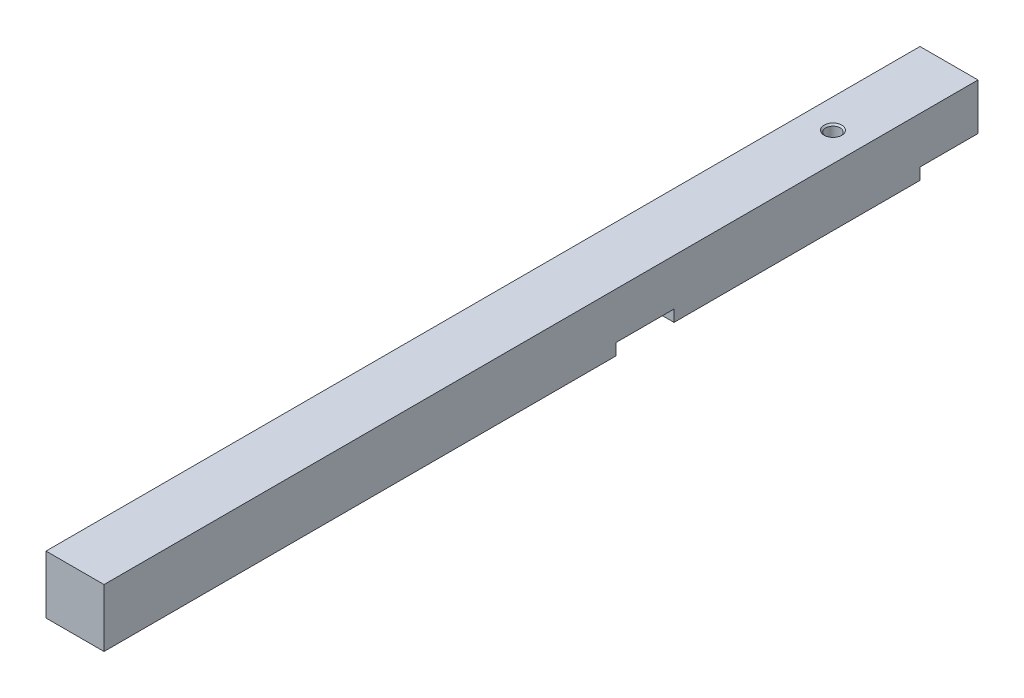
from build123d import *

# Parameters (mm, degrees)
ESQUISSE1_W                     = 10
ESQUISSE1_H                     = 10
BOSS_EXTRU_1_DEPTH              = 150.664880645
ESQUISSE2_W                     = 10
ESQUISSE2_H                     = 2
ENL_V_MAT_EXTRU_1_DEPTH         = 152.079139062
TROU_TARAUD_M3X0_51_D           = 2.5
TROU_TARAUD_M3X0_51_CSINK_D     = 3.05
TROU_TARAUD_M3X0_51_CSINK_ANGLE = 90


with BuildPart() as part:
    # Esquisse1 → Boss.-Extru.1 (new body)
    with BuildSketch(Plane.XY):
        Rectangle(ESQUISSE1_W, ESQUISSE1_H)
    extrude(amount=BOSS_EXTRU_1_DEPTH)

    # Esquisse2 → Enlèv. mat.-Extru.1 (cut, through all)
    with BuildSketch(Plane.ZY.offset(5)):
        with Locations((5, -4)):
            Rectangle(ESQUISSE2_W, ESQUISSE2_H)
        with Locations((57.4, -4)):
            Rectangle(ESQUISSE2_W, ESQUISSE2_H)
    extrude(amount=-ENL_V_MAT_EXTRU_1_DEPTH, mode=Mode.SUBTRACT)

    # Trou taraudé M3x0.51 (through all)
    with Locations(Plane(origin=(0, 5, 0), x_dir=(1, 0, 0), z_dir=(0, 1, 0))):
        with Locations((0, -20)):
            CounterSinkHole(TROU_TARAUD_M3X0_51_D / 2, TROU_TARAUD_M3X0_51_CSINK_D / 2, counter_sink_angle=TROU_TARAUD_M3X0_51_CSINK_ANGLE)


solid = part.part
